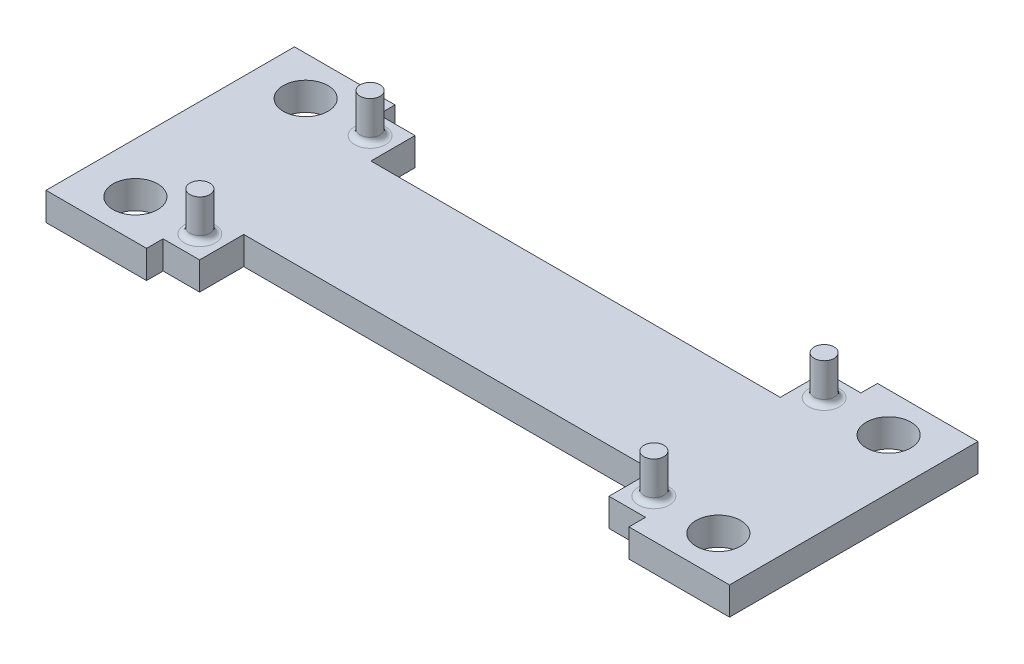
from build123d import *

# Parameters (mm, degrees)
SKETCH1_R           = 0.89
SKETCH1_R_2         = 2
SKETCH1_W           = 3.27
SKETCH1_H           = 0.75
BOSS_EXTRUDE1_DEPTH = 2.5
SKETCH2_R           = 0.89
BOSS_EXTRUDE2_DEPTH = 6
FILLET1_R           = 0.5


with BuildPart() as part:
    # Sketch1 → Boss-Extrude1 (new body)
    # profile 1 of 7: a face of its own
    with BuildSketch(Plane(origin=(0, 0, 0), x_dir=(1, 0, 0), z_dir=(0, 1, 0))):
        Polygon((0, 17.78), (0, 0), (3.27, 0), (3.27, 3.2), (39.91, 3.2), (39.91, 0), (43.18, 0), (43.18, 17.78), (39.91, 17.78), (39.91, 14.58), (3.27, 14.58), (3.27, 17.78), align=None)
        with Locations(Location((1.27, 1.27, 0), (0, 0, 270))):
            Circle(SKETCH1_R, mode=Mode.SUBTRACT)
        with Locations(Location((41.91, 1.27, 0), (0, 0, 270))):
            Circle(SKETCH1_R, mode=Mode.SUBTRACT)
        with Locations(Location((1.27, 16.51, 0), (0, 0, 270))):
            Circle(SKETCH1_R, mode=Mode.SUBTRACT)
        with Locations(Location((41.91, 16.51, 0), (0, 0, 270))):
            Circle(SKETCH1_R, mode=Mode.SUBTRACT)
    # profile 2 of 7: a face of its own
    with BuildSketch(Plane(origin=(0, 0, 0), x_dir=(1, 0, 0), z_dir=(0, 1, 0))):
        Polygon((0, -0.75), (0, 0), (0, 17.78), (0, 18.53), (0, 20.01), (-9, 20.01), (-9, -2.23), (0, -2.23), align=None)
        with Locations(Location((-4.5, 1.27, 0), (0, 0, 270))):
            Circle(SKETCH1_R_2, mode=Mode.SUBTRACT)
        with Locations(Location((-4.5, 16.51, 0), (0, 0, 270))):
            Circle(SKETCH1_R_2, mode=Mode.SUBTRACT)
    # profile 3 of 7: a face of its own
    with BuildSketch(Plane(origin=(0, 0, 0), x_dir=(1, 0, 0), z_dir=(0, 1, 0))):
        Polygon((43.18, 17.78), (43.18, 0), (43.18, -0.75), (43.18, -2.23), (52.18, -2.23), (52.18, 20.01), (43.18, 20.01), (43.18, 18.53), align=None)
        with Locations(Location((47.68, 1.27, 0), (0, 0, 270))):
            Circle(SKETCH1_R_2, mode=Mode.SUBTRACT)
        with Locations(Location((47.68, 16.51, 0), (0, 0, 270))):
            Circle(SKETCH1_R_2, mode=Mode.SUBTRACT)
    # profile 4 of 7: a face of its own
    with BuildSketch(Plane(origin=(0, 0, 0), x_dir=(1, 0, 0), z_dir=(0, 1, 0))):
        with Locations((41.545, -0.375)):
            Rectangle(SKETCH1_W, SKETCH1_H)
    # profile 5 of 7: a face of its own
    with BuildSketch(Plane(origin=(0, 0, 0), x_dir=(1, 0, 0), z_dir=(0, 1, 0))):
        with Locations((41.545, 18.155)):
            Rectangle(SKETCH1_W, SKETCH1_H)
    # profile 6 of 7: a face of its own
    with BuildSketch(Plane(origin=(0, 0, 0), x_dir=(1, 0, 0), z_dir=(0, 1, 0))):
        with Locations((1.635, 18.155)):
            Rectangle(SKETCH1_W, SKETCH1_H)
    # profile 7 of 7: a face of its own
    with BuildSketch(Plane(origin=(0, 0, 0), x_dir=(1, 0, 0), z_dir=(0, 1, 0))):
        with Locations((1.635, -0.375)):
            Rectangle(SKETCH1_W, SKETCH1_H)
    extrude(amount=BOSS_EXTRUDE1_DEPTH)

    # Sketch2 → Boss-Extrude2 (add)
    with BuildSketch(Plane.XZ):
        with Locations(Location((1.27, -16.51, 0), (0, 0, 270))):
            Circle(SKETCH2_R)
        with Locations(Location((1.27, -1.27, 0), (0, 0, 270))):
            Circle(SKETCH2_R)
        with Locations(Location((41.91, -16.51, 0), (0, 0, 270))):
            Circle(SKETCH2_R)
        with Locations(Location((41.91, -1.27, 0), (0, 0, 270))):
            Circle(SKETCH2_R)
    extrude(amount=-BOSS_EXTRUDE2_DEPTH)

    # Fillet1
    fillet1_edges = [part.edges().sort_by_distance(p)[0] for p in [
        (41.91, 2.5, -0.38),
        (41.91, 2.5, -15.62),
        (1.27, 2.5, -0.38),
        (1.27, 2.5, -15.62),
    ]]
    fillet(fillet1_edges, radius=FILLET1_R)


solid = part.part
